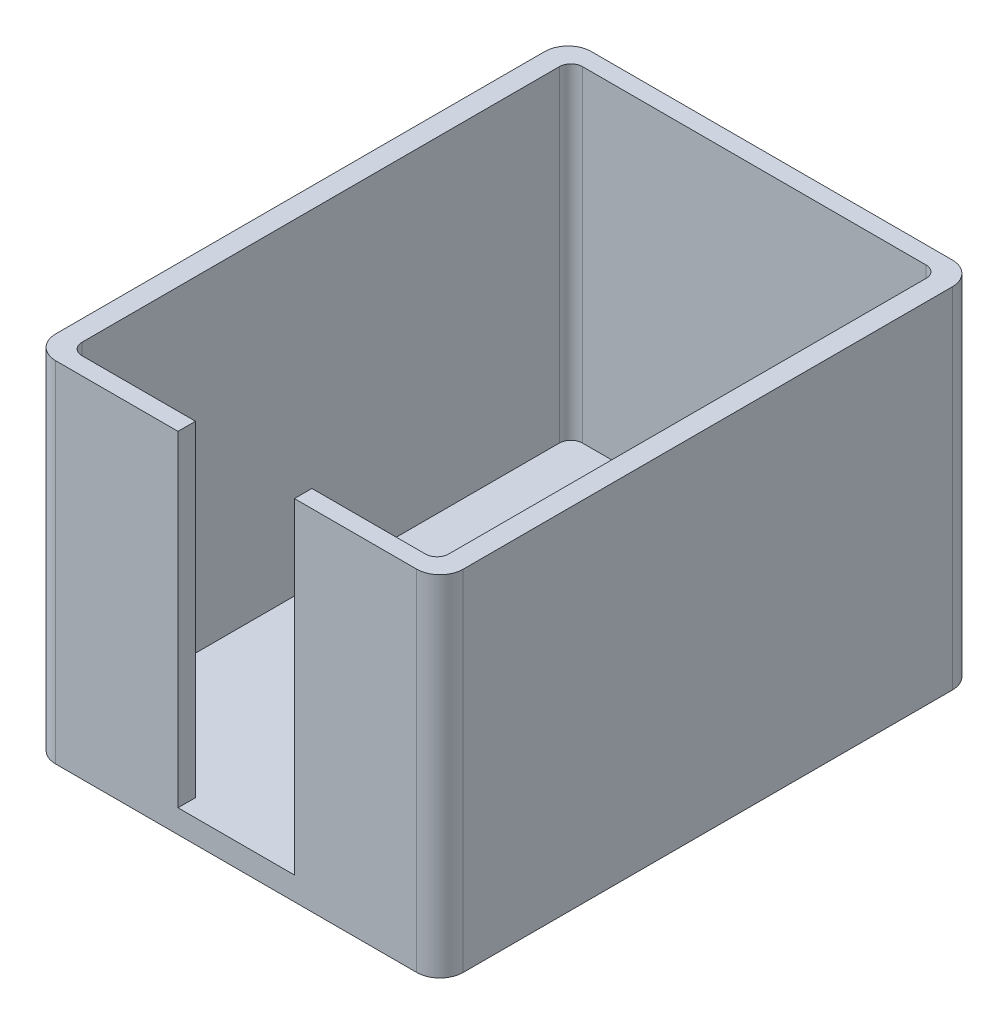
from build123d import *

# Parameters (mm, degrees)
SKETCH1_W           = 35
SKETCH1_H           = 46
BOSS_EXTRUDE1_DEPTH = 30
SKETCH2_W           = 31.5
SKETCH2_H           = 43
CUT_EXTRUDE1_DEPTH  = 28
FILLET1_R           = 2
FILLET2_R           = 1
SKETCH3_W           = 10
SKETCH3_H           = 28
CUT_EXTRUDE2_DEPTH  = 8


with BuildPart() as part:
    # Sketch1 → Boss-Extrude1 (new body)
    with BuildSketch(Plane(origin=(0, 0, 0), x_dir=(1, 0, 0), z_dir=(0, 1, 0))):
        Rectangle(SKETCH1_W, SKETCH1_H)
    extrude(amount=BOSS_EXTRUDE1_DEPTH)

    # Sketch2 → Cut-Extrude1 (cut)
    with BuildSketch(Plane(origin=(0, 30, 0), x_dir=(1, 0, 0), z_dir=(0, 1, 0))):
        Rectangle(SKETCH2_W, SKETCH2_H)
    extrude(amount=-CUT_EXTRUDE1_DEPTH, mode=Mode.SUBTRACT)

    # Fillet1
    fillet1_edges = [part.edges().sort_by_distance(p)[0] for p in [
        (17.5, 15, 23),
        (-17.5, 15, 23),
        (-17.5, 15, -23),
        (17.5, 15, -23),
    ]]
    fillet(fillet1_edges, radius=FILLET1_R)

    # Fillet2
    fillet2_edges = [part.edges().sort_by_distance(p)[0] for p in [
        (15.75, 16, -21.5),
        (15.75, 16, 21.5),
        (-15.75, 16, 21.5),
        (-15.75, 16, -21.5),
    ]]
    fillet(fillet2_edges, radius=FILLET2_R)

    # Sketch3 → Cut-Extrude2 (cut)
    with BuildSketch(Plane.XY.offset(23)):
        with Locations((0, 16)):
            Rectangle(SKETCH3_W, SKETCH3_H)
    extrude(amount=-CUT_EXTRUDE2_DEPTH, mode=Mode.SUBTRACT)


solid = part.part
